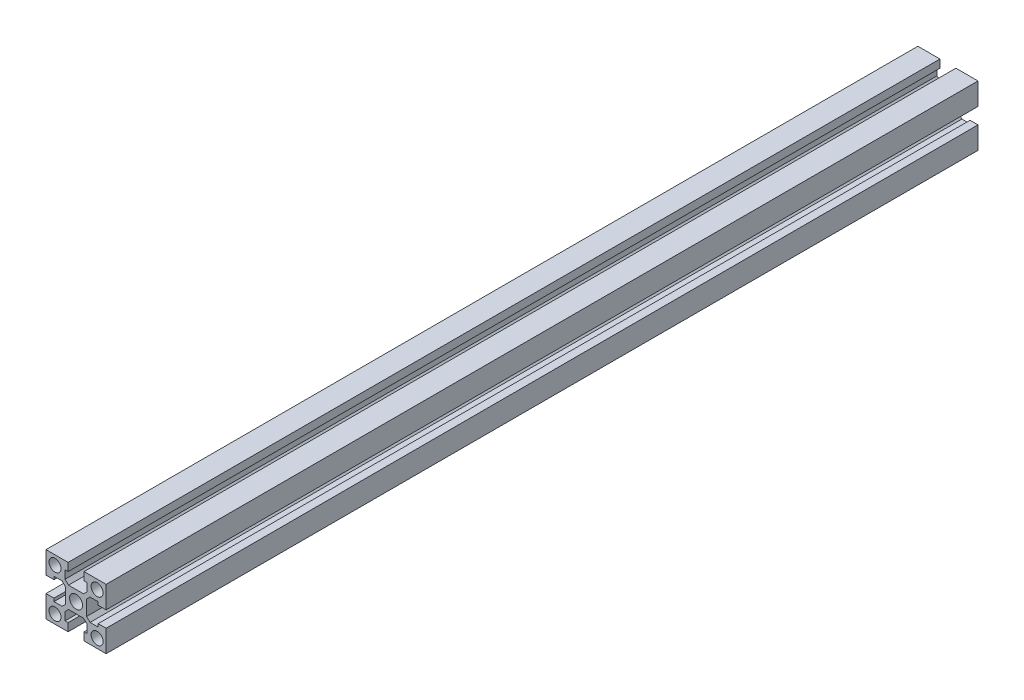
from build123d import *

# Parameters (mm, degrees)
SKETCH_1_R      = 2
SKETCH_1_R_2    = 2.15
EXTRUDE_1_DEPTH = 145


with BuildPart() as part:
    # 스케치1 → 보스-돌출1 (new, symmetric)
    with BuildSketch(Plane.XY):
        Polygon((-10, -10), (-2.65, -10), (-2.65, -7.35), (-3.65, -7.35), (-3.65, -4.639949494), (-2.510050506, -3.5), (0, -3.5), (2.510050506, -3.5), (3.65, -4.639949494), (3.65, -7.35), (2.65, -7.35), (2.65, -10), (10, -10), (10, -2.65), (7.35, -2.65), (7.35, -3.65), (4.639949494, -3.65), (3.5, -2.510050506), (3.5, 0), (3.5, 2.510050506), (4.639949494, 3.65), (7.35, 3.65), (7.35, 2.65), (10, 2.65), (10, 10), (2.65, 10), (2.65, 7.35), (3.65, 7.35), (3.65, 4.639949494), (2.510050506, 3.5), (0, 3.5), (-2.510050506, 3.5), (-3.65, 4.639949494), (-3.65, 7.35), (-2.65, 7.35), (-2.65, 10), (-10, 10), (-10, 2.65), (-7.35, 2.65), (-7.35, 3.65), (-4.639949494, 3.65), (-3.5, 2.510050506), (-3.5, 0), (-3.5, -2.510050506), (-4.639949494, -3.65), (-7.35, -3.65), (-7.35, -2.65), (-10, -2.65), align=None)
        with Locations((-7, 7)):
            Circle(SKETCH_1_R, mode=Mode.SUBTRACT)
        Circle(SKETCH_1_R_2, mode=Mode.SUBTRACT)
        with Locations((7, 7)):
            Circle(SKETCH_1_R, mode=Mode.SUBTRACT)
        with Locations((-7, -7)):
            Circle(SKETCH_1_R, mode=Mode.SUBTRACT)
        with Locations((7, -7)):
            Circle(SKETCH_1_R, mode=Mode.SUBTRACT)
    extrude(amount=EXTRUDE_1_DEPTH, both=True)


solid = part.part
